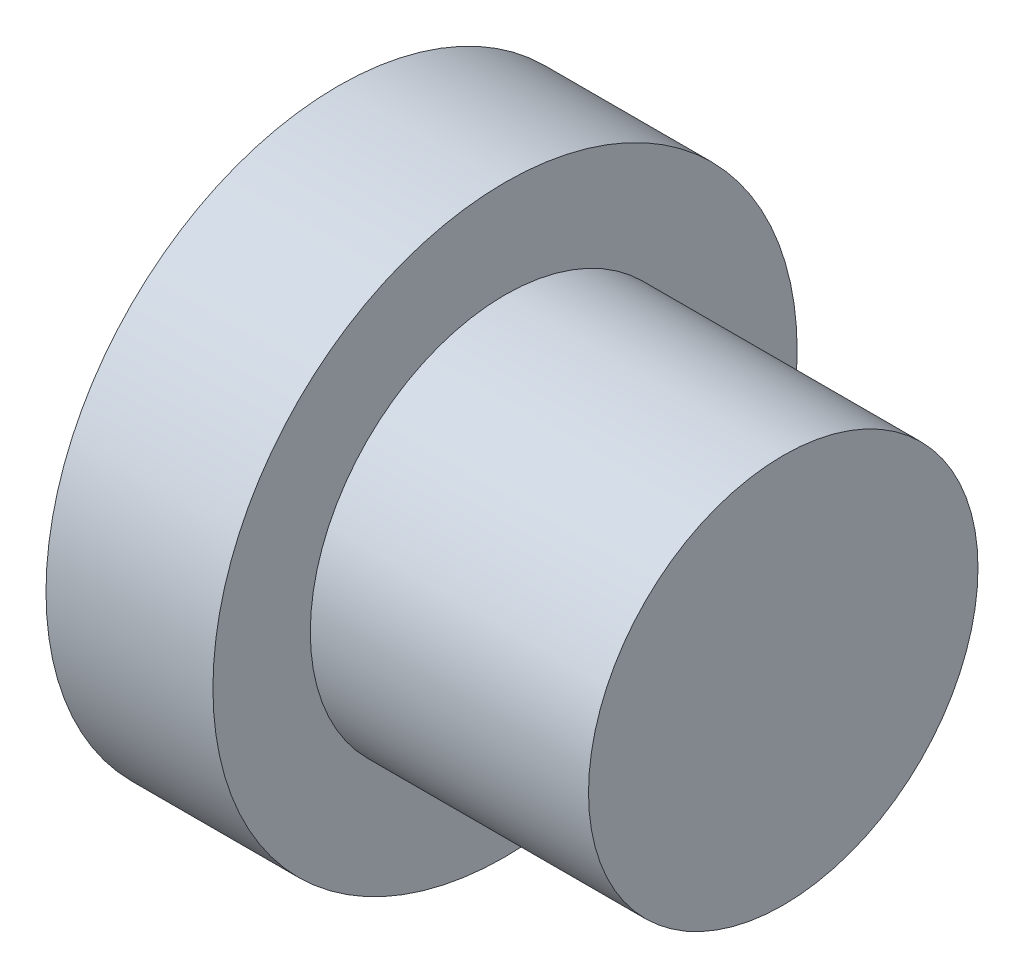
from build123d import *

# Parameters (mm, degrees)
SKETCH1_R           = 5.25
BOSS_EXTRUDE1_DEPTH = 3
SKETCH2_R           = 3.5
BOSS_EXTRUDE2_DEPTH = 5


with BuildPart() as part:
    # Sketch1 → Boss-Extrude1 (new body)
    with BuildSketch(Plane(origin=(0, 0, 0), x_dir=(0, 0, -1), z_dir=(1, 0, 0))):
        Circle(SKETCH1_R)
    extrude(amount=BOSS_EXTRUDE1_DEPTH)

    # Sketch2 → Boss-Extrude2 (add)
    with BuildSketch(Plane(origin=(3, 0, 0), x_dir=(0, 0, -1), z_dir=(1, 0, 0))):
        Circle(SKETCH2_R)
    extrude(amount=BOSS_EXTRUDE2_DEPTH)


solid = part.part
